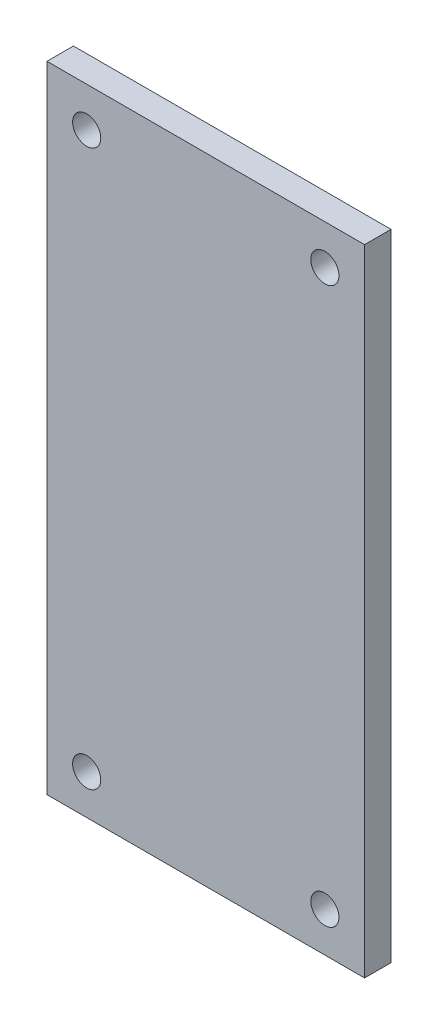
from build123d import *

# Parameters (mm, degrees)
SKETCH1_W               = 76.2
SKETCH1_H               = 152.4
BOSS_EXTRUDE1_DEPTH     = 6.35
F_1_4_CLEARANCE_HOLE1_D = 6.7564


with BuildPart() as part:
    # Sketch1 → Boss-Extrude1 (new body)
    with BuildSketch(Plane.XY):
        Rectangle(SKETCH1_W, SKETCH1_H)
    extrude(amount=BOSS_EXTRUDE1_DEPTH)

    # 1/4 Clearance Hole1 (through all)
    with Locations(Plane.XY.offset(6.35)):
        with Locations((-28.575, 66.675), (28.575, 66.675)):
            f_1_4_clearance_hole1 = Hole(F_1_4_CLEARANCE_HOLE1_D / 2)

    # Mirror1: 1/4 Clearance Hole1 across plane
    add(f_1_4_clearance_hole1.mirror(Plane.ZX), mode=Mode.SUBTRACT)


solid = part.part
